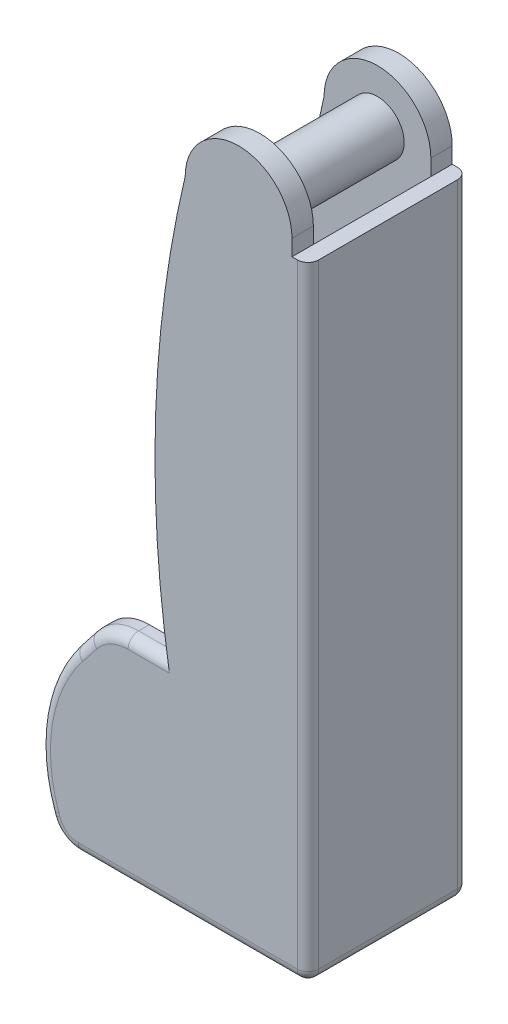
from build123d import *

# Parameters (mm, degrees)
BOSS_EXTRUDE1_DEPTH     = 7.5
CUT_EXTRUDE1_DEPTH      = 5
CUT_EXTRUDE1_DEPTH_BACK = 25
SKETCH3_W               = 11
SKETCH3_H               = 65
SKETCH5_R               = 2.5
BOSS_EXTRUDE3_DEPTH     = 11
SKETCH6_R               = 2.5
BOSS_EXTRUDE4_DEPTH     = 13
FILLET1_R               = 1
FILLET2_R               = 4.7
FILLET3_R               = 15.1
FILLET4_R               = 2.8
FILLET7_R               = 1
CUT_EXTRUDE2_START      = -1.5
CUT_EXTRUDE2_DEPTH      = 1.5


with BuildPart() as part:
    # Sketch1 → Boss-Extrude1 (new, symmetric)
    with BuildSketch(Plane.XY):
        with BuildLine():
            Line((5, 41.700950662), (6.5, 41.700950662))
            Line((6.5, 41.700950662), (6.5, -18.299049338))
            Line((6.5, -18.299049338), (-17, -18.299049338))
            Line((-17, -18.299049338), (-20.5, -8.299049338))
            Line((-20.5, -8.299049338), (-12.631273367, 1.700950662))
            Line((-12.631273367, 1.700950662), (-6.631273367, 1.700950662))
            ThreePointArc((-6.631273367, 1.700950662), (-7.739623811, 21.779414386), (-5, 41.700950662))
            ThreePointArc((-5, 41.700950662), (0, 46.700950662), (5, 41.700950662))
        make_face()
    extrude(amount=BOSS_EXTRUDE1_DEPTH, both=True)

    # Sketch3 → Cut-Extrude1 (cut, two sides: drawn at the far end of the back side and taken through both)
    with BuildSketch(Plane(origin=(0, 0, 0), x_dir=(0, 0, -1), z_dir=(1, 0, 0)).offset(-CUT_EXTRUDE1_DEPTH_BACK)):
        with Locations((0, 14.200950662)):
            Rectangle(SKETCH3_W, SKETCH3_H)
    extrude(amount=CUT_EXTRUDE1_DEPTH + CUT_EXTRUDE1_DEPTH_BACK, mode=Mode.SUBTRACT)

    # Sketch5 → Boss-Extrude3 (add)
    with BuildSketch(Plane.XY.offset(-5.5)):
        with Locations((0, 41.700950662)):
            Circle(SKETCH5_R)
    extrude(amount=BOSS_EXTRUDE3_DEPTH)

    # Sketch6 → Boss-Extrude4 (add)
    with BuildSketch(Plane.XY.offset(7.5)):
        with Locations(Location((0, -13.299049338, 0), (0, 0, 90))):
            Circle(SKETCH6_R)
    extrude(amount=-BOSS_EXTRUDE4_DEPTH)

    # Fillet1
    fillet1_edges = [part.edges().sort_by_distance(p)[0] for p in [
        (6.5, 11.700950662, 7.5),
        (6.5, 11.700950662, -7.5),
    ]]
    fillet(fillet1_edges, radius=FILLET1_R)

    # Fillet2
    fillet2_edges = [part.edges().sort_by_distance(p)[0] for p in [
        (-12.631273367, 1.700950662, 6.5),
        (-12.631273367, 1.700950662, -6.5),
    ]]
    fillet(fillet2_edges, radius=FILLET2_R)

    # Fillet3
    fillet3_edges = [part.edges().sort_by_distance(p)[0] for p in [
        (-20.5, -8.299049338, 6.5),
        (-20.5, -8.299049338, -6.5),
    ]]
    fillet(fillet3_edges, radius=FILLET3_R)

    # Fillet4
    fillet4_edges = [part.edges().sort_by_distance(p)[0] for p in [
        (-17, -18.299049338, 6.5),
        (-17, -18.299049338, -6.5),
    ]]
    fillet(fillet4_edges, radius=FILLET4_R)

    # Fillet7
    fillet7_edges = [part.edges().sort_by_distance(p)[0] for p in [
        (-4.756726593, -18.299049338, -7.5),
        (-4.756726593, -18.299049338, 7.5),
        (-16.633646488, -17.782681021, 7.5),
        (-16.633646488, -17.782681021, -7.5),
        (-8.490130072, 1.700950662, 7.5),
        (6.5, -18.299049338, 0),
        (6.207106781, -18.299049338, 7.207106781),
        (6.207106781, -18.299049338, -7.207106781),
        (-8.490130072, 1.700950662, -7.5),
        (-14.710530592, -0.941480981, 7.5),
        (-12.40202012, 1.22884069, 7.5),
        (-14.710530592, -0.941480981, -7.5),
        (-12.40202012, 1.22884069, -7.5),
        (-17.710124778, -16.2701214, 7.5),
        (-18.406636263, -8.647634431, 7.5),
        (-17.710124778, -16.2701214, -7.5),
        (-18.406636263, -8.647634431, -7.5),
    ]]
    fillet(fillet7_edges, radius=FILLET7_R)

    # Sketch7 → Cut-Extrude2 (cut)
    with BuildSketch(Plane(origin=(0, 41.700950662, 0), x_dir=(1, 0, 0), z_dir=(0, 1, 0)).offset(CUT_EXTRUDE2_START)):
        with BuildLine():
            Line((6.5, -6.5), (6.5, 6.5))
            ThreePointArc((6.5, 6.5), (6.207106781, 7.207106781), (5.5, 7.5))
            Line((5.5, 7.5), (5, 7.5))
            Line((5, 7.5), (5, 5.5))
            Line((5, 5.5), (5, -5.5))
            Line((5, -5.5), (5, -7.5))
            Line((5, -7.5), (5.5, -7.5))
            ThreePointArc((5.5, -7.5), (6.207106781, -7.207106781), (6.5, -6.5))
        make_face()
    extrude(amount=CUT_EXTRUDE2_DEPTH, mode=Mode.SUBTRACT)


solid = part.part
